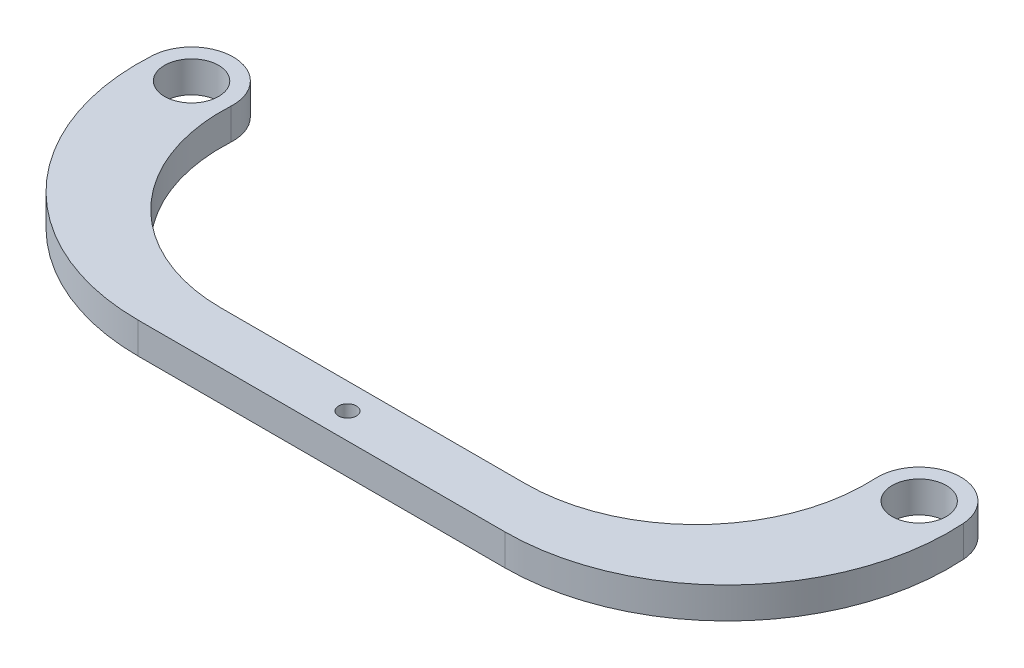
from build123d import *

# Parameters (mm, degrees)
SKETCH_1_R      = 2.6
SKETCH_1_R_2    = 0.85
EXTRUDE_1_DEPTH = 3


with BuildPart() as part:
    # 草图1 → 凸台-拉伸1 (new body)
    with BuildSketch(Plane(origin=(0, 0, 0), x_dir=(1, 0, 0), z_dir=(0, 1, 0))):
        with BuildLine():
            Line((14.641409653, 2.5), (-14.641409653, 2.5))
            ThreePointArc((-14.641409653, 2.5), (-26.541683504, 7.620386051), (-31.005944031, 19.782016246))
            ThreePointArc((-31.005944031, 19.782016246), (-34.76320991, 23.992985156), (-38.991825792, 20.255591176))
            ThreePointArc((-38.991825792, 20.255591176), (-33.246595423, 4.255838584), (-17.646646706, -2.5))
            Line((-17.646646706, -2.5), (17.646646706, -2.5))
            ThreePointArc((17.646646706, -2.5), (33.246595423, 4.255838584), (38.991825792, 20.255591176))
            ThreePointArc((38.991825792, 20.255591176), (34.76320991, 23.992985156), (31.005944031, 19.782016246))
            ThreePointArc((31.005944031, 19.782016246), (26.541683504, 7.620386051), (14.641409653, 2.5))
        make_face()
        with Locations(Location((35, 20, 0), (0, 0, 270))):
            Circle(SKETCH_1_R, mode=Mode.SUBTRACT)
        with Locations(Location((-35, 20, 0), (0, 0, 270))):
            Circle(SKETCH_1_R, mode=Mode.SUBTRACT)
        with Locations(Location((0, 0, 0), (0, 0, 270))):
            Circle(SKETCH_1_R_2, mode=Mode.SUBTRACT)
    extrude(amount=EXTRUDE_1_DEPTH)


solid = part.part
